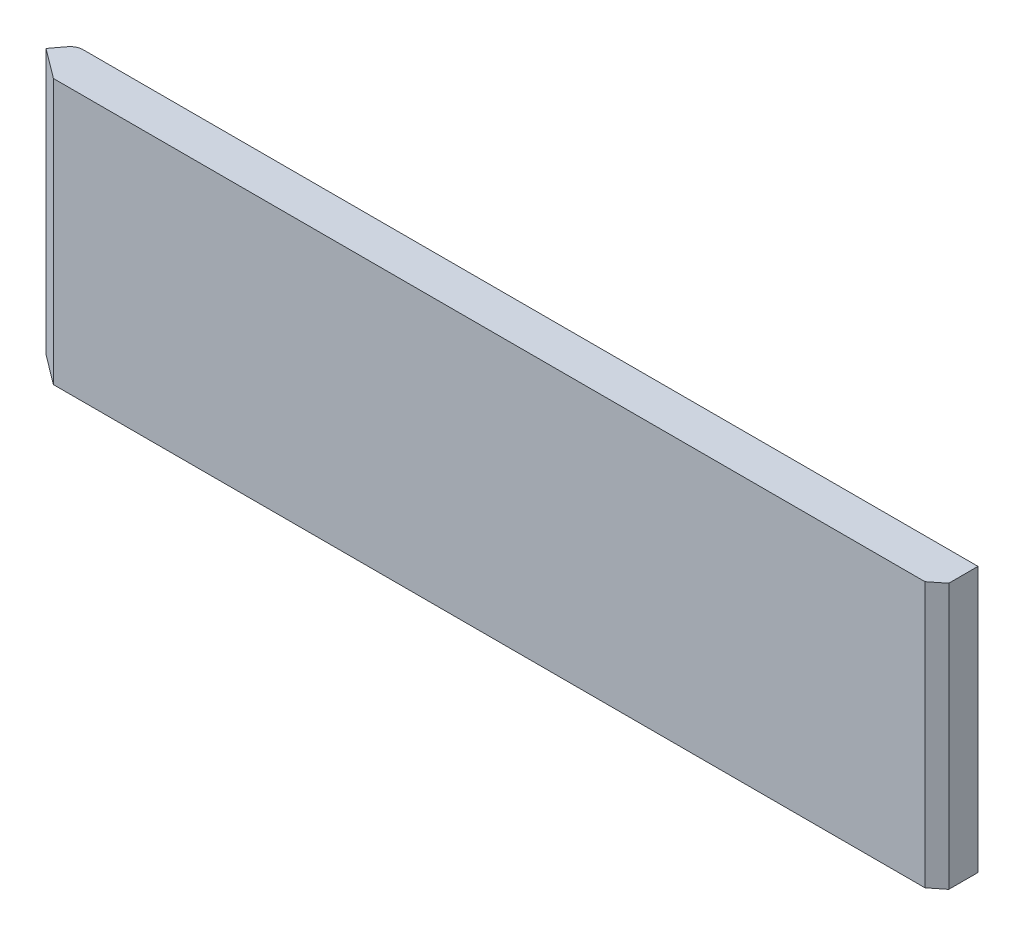
from build123d import *

# Parameters (mm, degrees)
BOSS_EXTRUDE1_DEPTH     = 20
CUT_EXTRUDE1_START      = -35
SKETCH2_R               = 1.5
SKETCH2_R_2             = 1.572515875
CUT_EXTRUDE1_DEPTH      = 5
FILLET1_R               = 2
SKETCH3_W               = 103.784472799
SKETCH3_H               = 73.748761466
CUT_EXTRUDE2_DEPTH      = 184.826439883
CUT_EXTRUDE3_DEPTH      = 85.597401851
CUT_EXTRUDE3_DEPTH_BACK = 85.597401851
SKETCH4_W               = 26
SKETCH4_H               = 40
CUT_EXTRUDE4_DEPTH      = 100.602813213
CUT_EXTRUDE4_DEPTH_BACK = 100.602813213


with BuildPart() as part:
    # Sketch1 → Boss-Extrude1 (new, symmetric)
    with BuildSketch(Plane(origin=(0, 0, 0), x_dir=(1, 0, 0), z_dir=(0, 1, 0))):
        Polygon((-110, 0), (-80, 40), (80, 40), (110, 0), (103, 0), (77.5, 34), (-77.5, 34), (-103, 0), align=None)
    extrude(amount=BOSS_EXTRUDE1_DEPTH, both=True)

    # Sketch2 → Cut-Extrude1 (cut)
    with BuildSketch(Plane(origin=(0, 20, 0), x_dir=(1, 0, 0), z_dir=(0, 1, 0)).offset(CUT_EXTRUDE1_START)):
        with Locations(Location((-104, 3, 0), (0, 0, 270))):
            Circle(SKETCH2_R)
        with Locations(Location((-57, 37, 0), (0, 0, 270))):
            Circle(SKETCH2_R)
        with Locations(Location((-7, 37, 0), (0, 0, 270))):
            Circle(SKETCH2_R)
        with Locations(Location((7, 37, 0), (0, 0, 90))):
            Circle(SKETCH2_R)
        with Locations(Location((104, 3, 0), (0, 0, 90))):
            Circle(SKETCH2_R)
        with Locations(Location((52, 37, 0), (0, 0, 270))):
            Circle(SKETCH2_R_2)
    extrude(amount=-CUT_EXTRUDE1_DEPTH, mode=Mode.SUBTRACT)

    # Fillet1
    fillet1_edges = [part.edges().sort_by_distance(p)[0] for p in [
        (-80, 0, -40),
        (80, 0, -40),
    ]]
    fillet(fillet1_edges, radius=FILLET1_R)

    # Sketch3 → Cut-Extrude2 (cut, symmetric)
    with BuildSketch(Plane(origin=(-65.92, 0, -49.44), x_dir=(0.5999999999999999, 0, -0.8000000000000002), z_dir=(0.8000000000000003, 0, 0.5999999999999999))):
        with Locations((-71.1922364, 16.874380733)):
            Rectangle(SKETCH3_W, SKETCH3_H)
    cut_extrude2 = extrude(amount=CUT_EXTRUDE2_DEPTH, both=True, mode=Mode.SUBTRACT)

    # Mirror1: Cut-Extrude2 across plane
    add(cut_extrude2.mirror(Plane(origin=(0, 0, 0), x_dir=(0, 0, 1), z_dir=(1, 0, 0))), mode=Mode.SUBTRACT)

    # Sketch4 → Cut-Extrude3 (cut, two sides: drawn at the far end of the back side and taken through both)
    with BuildSketch(Plane.XY.offset(-34).offset(-CUT_EXTRUDE3_DEPTH_BACK)):
        with Locations((68.98, 0)):
            Rectangle(SKETCH4_W, SKETCH4_H)
    extrude(amount=CUT_EXTRUDE3_DEPTH + CUT_EXTRUDE3_DEPTH_BACK, mode=Mode.SUBTRACT)

    # Sketch5 → Cut-Extrude4 (cut, two sides: drawn at the far end of the back side and taken through both)
    with BuildSketch(Plane.XZ.offset(20).offset(-CUT_EXTRUDE4_DEPTH_BACK)):
        Polygon((55.98, -35.588024178), (53.98, -34), (55.98, -34), align=None)
    extrude(amount=CUT_EXTRUDE4_DEPTH + CUT_EXTRUDE4_DEPTH_BACK, mode=Mode.SUBTRACT)


solid = part.part
